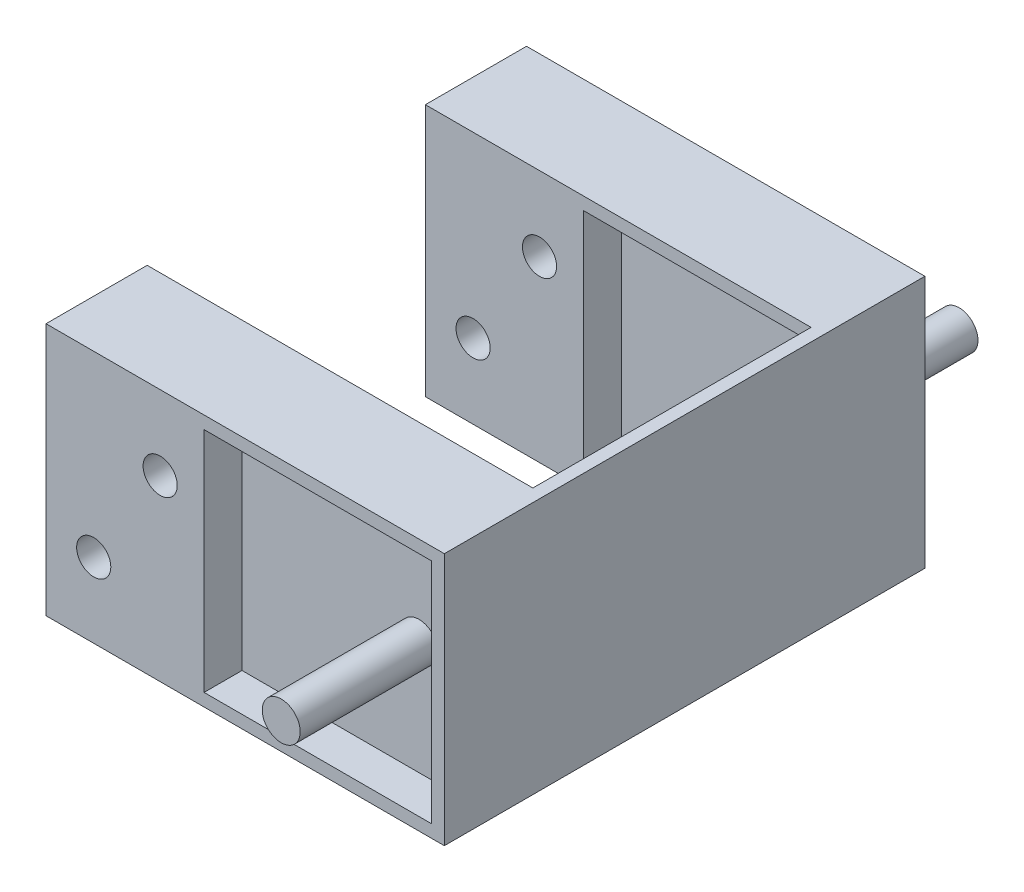
from build123d import *

# Parameters (mm, degrees)
SKETCH1_W           = 31.5
SKETCH1_H           = 20
SKETCH1_W_2         = 29.5
SKETCH1_H_2         = 18
EXTRUDE_THIN1_DEPTH = 8
BOSS_EXTRUDE1_START = 4
SKETCH2_W           = 31.5
SKETCH2_H           = 20
BOSS_EXTRUDE1_DEPTH = 1
SKETCH4_W           = 12.5
SKETCH4_H           = 20
BOSS_EXTRUDE2_DEPTH = 8
SKETCH5_R           = 1.35
CUT_EXTRUDE2_DEPTH  = 8
SKETCH12_W          = 1
SKETCH12_H          = 20
BOSS_EXTRUDE4_DEPTH = 22
BOSS_EXTRUDE6_START = 10.9
SKETCH3_R           = 1.5
BOSS_EXTRUDE6_DEPTH = 53.6


with BuildPart() as part:
    # Sketch1 → Extrude-Thin1 (new body)
    with BuildSketch(Plane.XY):
        with Locations((1.21969697, 10)):
            Rectangle(SKETCH1_W, SKETCH1_H)
        with Locations((1.21969697, 10)):
            Rectangle(SKETCH1_W_2, SKETCH1_H_2, mode=Mode.SUBTRACT)
    extrude(amount=EXTRUDE_THIN1_DEPTH)

    # Sketch2 → Boss-Extrude1 (add, symmetric)
    with BuildSketch(Plane.XY.offset(BOSS_EXTRUDE1_START)):
        with Locations((1.21969697, 10)):
            Rectangle(SKETCH2_W, SKETCH2_H)
    extrude(amount=BOSS_EXTRUDE1_DEPTH, both=True)

    # Sketch4 → Boss-Extrude2 (add)
    with BuildSketch(Plane.XY.offset(8)):
        with Locations((-8.28030303, 10)):
            Rectangle(SKETCH4_W, SKETCH4_H)
    extrude(amount=-BOSS_EXTRUDE2_DEPTH)

    # Sketch5 → Cut-Extrude2 (cut)
    with BuildSketch(Plane.XY.offset(8)):
        with Locations((-10.756674766, 5.895738268)):
            Circle(SKETCH5_R)
        with Locations((-5.502724413, 14.104261732)):
            Circle(SKETCH5_R)
    extrude(amount=-CUT_EXTRUDE2_DEPTH, mode=Mode.SUBTRACT)

    # Sketch12 → Boss-Extrude4 (add)
    with BuildSketch(Plane(origin=(0, 0, 0), x_dir=(-1, 0, 0), z_dir=(0, 0, -1))):
        with Locations((-16.46969697, 10)):
            Rectangle(SKETCH12_W, SKETCH12_H)
    extrude(amount=BOSS_EXTRUDE4_DEPTH)

    # Mirror5: part across plane


with BuildPart() as part_1:
    add(part.part)
    add(part.part.mirror(Plane.XY.offset(-11)))

    # Sketch3 → Boss-Extrude6 (add)
    with BuildSketch(Plane.XY.offset(5).offset(BOSS_EXTRUDE6_START)):
        with Locations((11.96969697, 10)):
            Circle(SKETCH3_R)
    extrude(amount=-BOSS_EXTRUDE6_DEPTH)


solid = part_1.part
